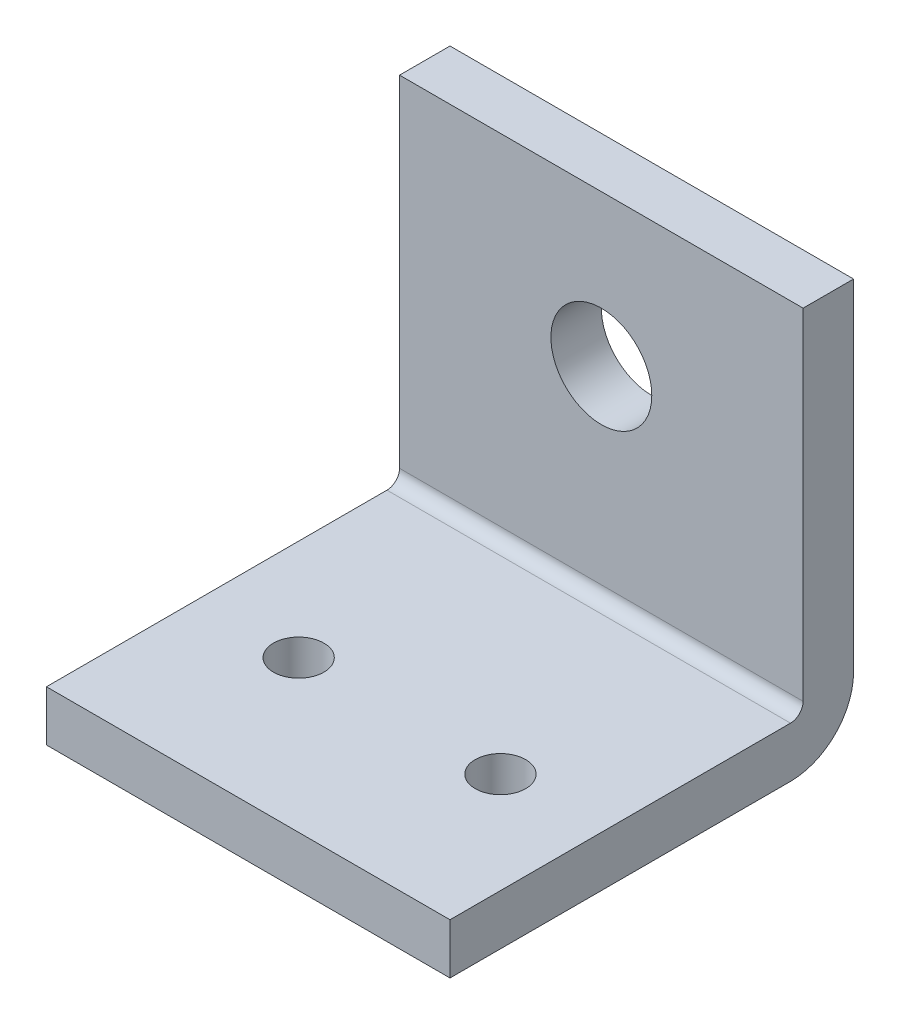
from build123d import *

# Parameters (mm, degrees)
SKETCH1_W           = 40
SKETCH1_H           = 40
SKETCH1_R           = 2.5
BOSS_EXTRUDE1_DEPTH = 5
SKETCH2_W           = 40
SKETCH2_H           = 5
BOSS_EXTRUDE2_DEPTH = 35
SKETCH3_R           = 5
CUT_EXTRUDE1_DEPTH  = 35
FILLET1_R           = 6.25
FILLET2_R           = 1.25


with BuildPart() as part:
    # Sketch1 → Boss-Extrude1 (new body)
    with BuildSketch(Plane(origin=(0, 0, 0), x_dir=(1, 0, 0), z_dir=(0, 1, 0))):
        with Locations((20, 20)):
            Rectangle(SKETCH1_W, SKETCH1_H)
        with Locations(Location((10, 15, 0), (0, 0, 270))):
            Circle(SKETCH1_R, mode=Mode.SUBTRACT)
        with Locations(Location((30, 15, 0), (0, 0, 270))):
            Circle(SKETCH1_R, mode=Mode.SUBTRACT)
    extrude(amount=BOSS_EXTRUDE1_DEPTH)

    # Sketch2 → Boss-Extrude2 (add)
    with BuildSketch(Plane(origin=(0, 5, 0), x_dir=(1, 0, 0), z_dir=(0, 1, 0))):
        with Locations((20, 37.5)):
            Rectangle(SKETCH2_W, SKETCH2_H)
    extrude(amount=BOSS_EXTRUDE2_DEPTH)

    # Sketch3 → Cut-Extrude1 (cut)
    with BuildSketch(Plane.XY.offset(-35)):
        with Locations((20, 25)):
            Circle(SKETCH3_R)
    extrude(amount=-CUT_EXTRUDE1_DEPTH, mode=Mode.SUBTRACT)

    # Fillet1
    fillet1_edges = [part.edges().sort_by_distance(p)[0] for p in [
        (20, 0, -40),
    ]]
    fillet(fillet1_edges, radius=FILLET1_R)

    # Fillet2
    fillet2_edges = [part.edges().sort_by_distance(p)[0] for p in [
        (20, 5, -35),
    ]]
    fillet(fillet2_edges, radius=FILLET2_R)


solid = part.part
